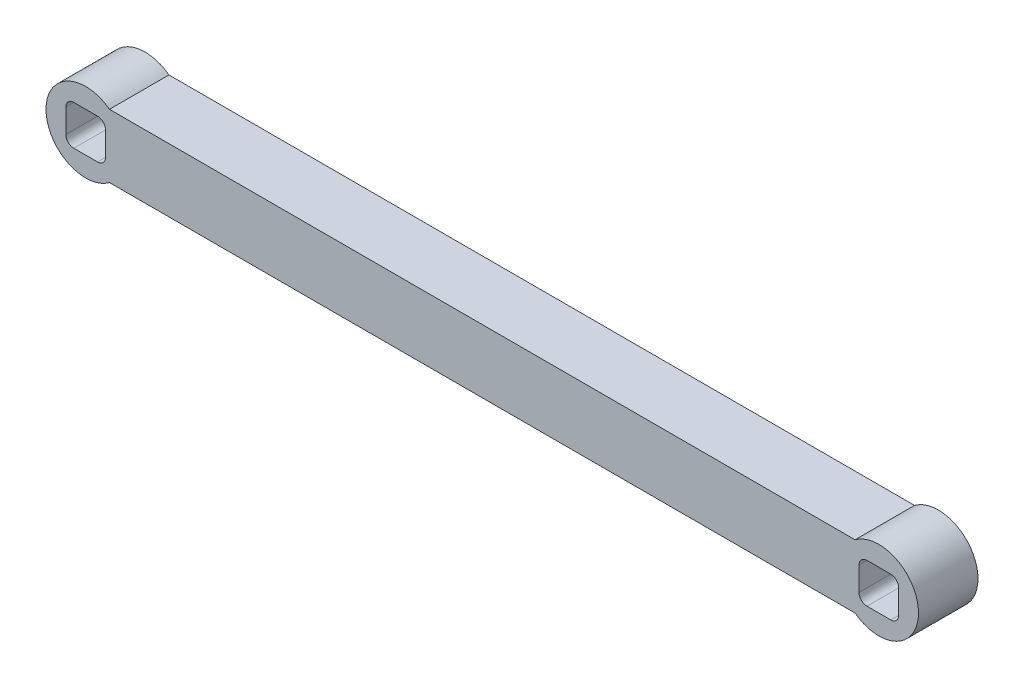
from build123d import *

# Parameters (mm, degrees)
SKETCH1_R           = 2.5
BOSS_EXTRUDE1_DEPTH = 7.5


with BuildPart() as part:
    # Sketch1 → Boss-Extrude1 (new body)
    # profile 1 of 2: a face of its own
    with BuildSketch(Plane.XY):
        with BuildLine():
            ThreePointArc((47, 4), (55, 0), (47, -4))
            Line((47, -4), (-47, -4))
            ThreePointArc((-47, -4), (-55, 0), (-47, 4))
            Line((-47, 4), (47, 4))
        make_face()
        Circle(SKETCH1_R, mode=Mode.SUBTRACT)
        with BuildLine():
            ThreePointArc((52.5, 1.5), (52.207106781, 2.207106781), (51.5, 2.5))
            Line((51.5, 2.5), (48.5, 2.5))
            ThreePointArc((48.5, 2.5), (47.792893219, 2.207106781), (47.5, 1.5))
            Line((47.5, 1.5), (47.5, -1.5))
            ThreePointArc((47.5, -1.5), (47.792893219, -2.207106781), (48.5, -2.5))
            Line((48.5, -2.5), (51.5, -2.5))
            ThreePointArc((51.5, -2.5), (52.207106781, -2.207106781), (52.5, -1.5))
            Line((52.5, -1.5), (52.5, 1.5))
        make_face(mode=Mode.SUBTRACT)
        with BuildLine():
            Line((-52.5, -1.5), (-52.5, 1.5))
            ThreePointArc((-52.5, 1.5), (-52.207106781, 2.207106781), (-51.5, 2.5))
            Line((-51.5, 2.5), (-48.5, 2.5))
            ThreePointArc((-48.5, 2.5), (-47.792893219, 2.207106781), (-47.5, 1.5))
            Line((-47.5, 1.5), (-47.5, -1.5))
            ThreePointArc((-47.5, -1.5), (-47.792893219, -2.207106781), (-48.5, -2.5))
            Line((-48.5, -2.5), (-51.5, -2.5))
            ThreePointArc((-51.5, -2.5), (-52.207106781, -2.207106781), (-52.5, -1.5))
        make_face(mode=Mode.SUBTRACT)
    # profile 2 of 2: a face of its own
    with BuildSketch(Plane.XY):
        Circle(SKETCH1_R)
    extrude(amount=BOSS_EXTRUDE1_DEPTH)


solid = part.part
